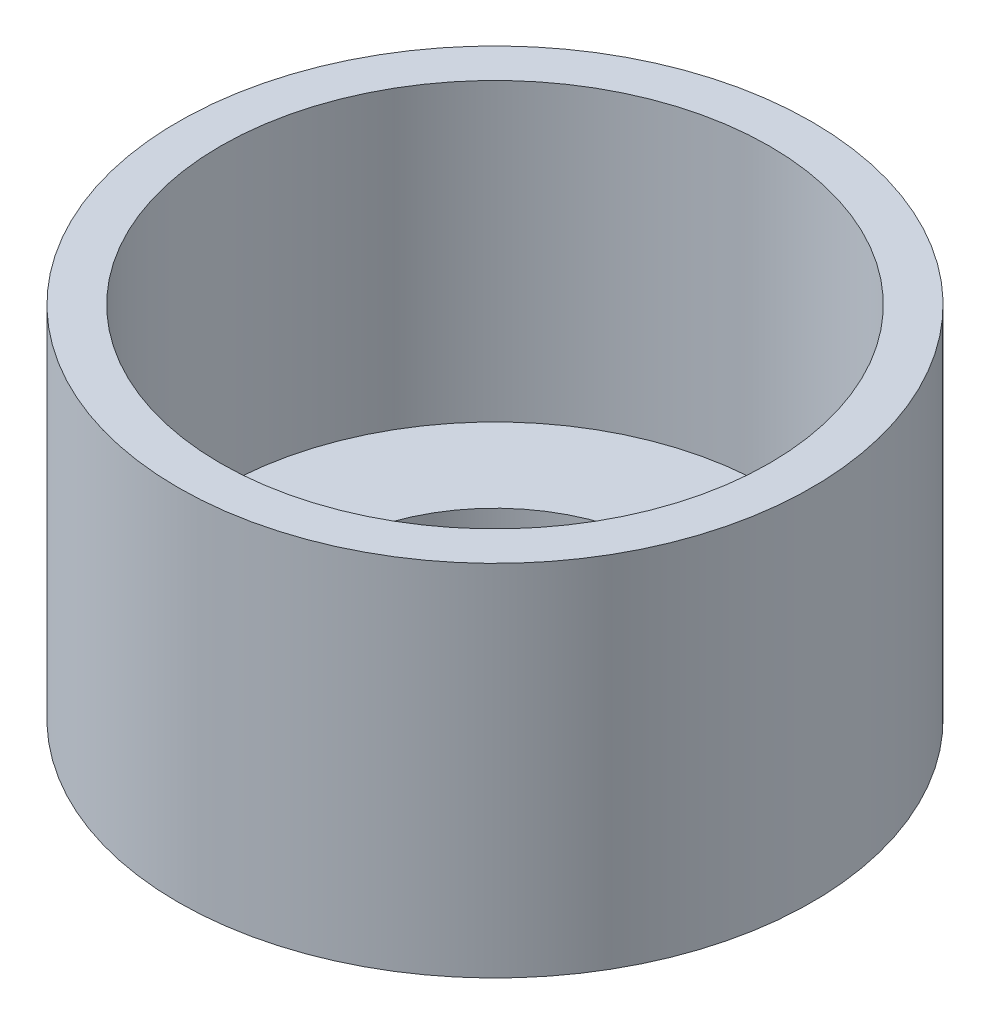
from build123d import *

# Parameters (mm, degrees)
SKETCH_1_R      = 15
SKETCH_1_R_2    = 8
EXTRUDE_1_DEPTH = 3
SKETCH_2_R      = 15
SKETCH_2_R_2    = 13
EXTRUDE_2_DEPTH = 14


with BuildPart() as part:
    # 스케치1 → 보스-돌출1 (new body)
    with BuildSketch(Plane(origin=(0, 0, 0), x_dir=(1, 0, 0), z_dir=(0, 1, 0))):
        with Locations(Location((0, 0, 0), (0, 0, 270))):
            Circle(SKETCH_1_R)
        with Locations(Location((0, 0, 0), (0, 0, 270))):
            Circle(SKETCH_1_R_2, mode=Mode.SUBTRACT)
    extrude(amount=EXTRUDE_1_DEPTH)

    # 스케치2 → 보스-돌출2 (add)
    with BuildSketch(Plane(origin=(0, 3, 0), x_dir=(1, 0, 0), z_dir=(0, 1, 0))):
        with Locations(Location((0, 0, 0), (0, 0, 270))):
            Circle(SKETCH_2_R)
        with Locations(Location((0, 0, 0), (0, 0, 270))):
            Circle(SKETCH_2_R_2, mode=Mode.SUBTRACT)
    extrude(amount=EXTRUDE_2_DEPTH)


solid = part.part
